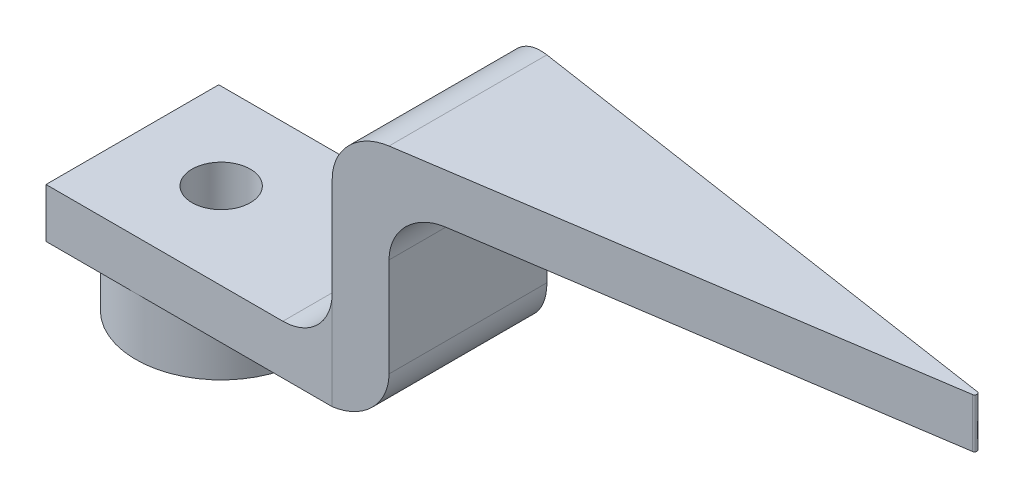
from build123d import *

# Parameters (mm, degrees)
EXTRUDE_THIN1_DEPTH = 4.445
CUT_EXTRUDE1_DEPTH  = 42.846259104
FILLET1_R           = 2.54
SKETCH3_R           = 1.5
CUT_EXTRUDE2_DEPTH  = 41.449549459
SKETCH4_R           = 4.4
BOSS_EXTRUDE1_DEPTH = 3
CUT_EXTRUDE3_DEPTH  = 3


with BuildPart() as part:
    # Sketch1 → Extrude-Thin1 (new, symmetric)
    with BuildSketch(Plane.XY):
        Polygon((39.624, 10.16), (12.7, 10.16), (12.7, 0), (0, 0), (-4.572, 0), (-4.572, 2.54), (0, 2.54), (10.16, 2.54), (10.16, 12.7), (39.624, 12.7), align=None)
    extrude(amount=EXTRUDE_THIN1_DEPTH, both=True)

    # Sketch2 → Cut-Extrude1 (cut, through all)
    with BuildSketch(Plane(origin=(0, 12.7, 0), x_dir=(1, 0, 0), z_dir=(0, 1, 0))):
        with BuildLine():
            Line((10.16, 4.445), (38.791590689, 0.125578991))
            ThreePointArc((38.791590689, 0.125578991), (38.899645583, 0), (38.791590689, -0.125578991))
            Line((38.791590689, -0.125578991), (10.16, -4.445))
            Line((10.16, -4.445), (39.624, -4.445))
            Line((39.624, -4.445), (39.624, 4.445))
            Line((39.624, 4.445), (10.16, 4.445))
        make_face()
    extrude(amount=-CUT_EXTRUDE1_DEPTH, mode=Mode.SUBTRACT)

    # Fillet1
    fillet1_edges = [part.edges().sort_by_distance(p)[0] for p in [
        (10.16, 2.54, 0),
        (12.7, 10.16, 0),
        (12.7, 0, 0),
        (10.16, 12.7, 0),
    ]]
    fillet(fillet1_edges, radius=FILLET1_R)

    # Sketch3 → Cut-Extrude2 (cut, through all)
    with BuildSketch(Plane(origin=(0, 2.54, 0), x_dir=(1, 0, 0), z_dir=(0, 1, 0))):
        with Locations(Location((0, 0, 0), (0, 0, 180))):
            Circle(SKETCH3_R)
    extrude(amount=-CUT_EXTRUDE2_DEPTH, mode=Mode.SUBTRACT)

    # Sketch4 → Boss-Extrude1 (add)
    with BuildSketch(Plane.XZ):
        Circle(SKETCH4_R)
    extrude(amount=BOSS_EXTRUDE1_DEPTH)

    # Sketch5 → Cut-Extrude3 (cut)
    with BuildSketch(Plane.XZ.offset(3)):
        with BuildLine():
            ThreePointArc((0.25256566, 2.479168093), (0.183492188, 2.485235293), (0.114276653, 2.489378375))
            Line((0.114276653, 2.489378375), (0.040605305, 2.356715865))
            Line((0.040605305, 2.356715865), (-0.040605305, 2.356715865))
            Line((-0.040605305, 2.356715865), (-0.114276653, 2.489378375))
            ThreePointArc((-0.114276653, 2.489378375), (-0.183492187, 2.485235293), (-0.252565658, 2.479168093))
            Line((-0.252565658, 2.479168093), (-0.268731935, 2.342929811))
            Line((-0.268731935, 2.342929811), (-0.349152209, 2.331627478))
            Line((-0.349152209, 2.331627478), (-0.440569645, 2.452745856))
            ThreePointArc((-0.440569645, 2.452745856), (-0.518115927, 2.437543791), (-0.595141217, 2.419890654))
            Line((-0.595141217, 2.419890654), (-0.592189461, 2.282728322))
            Line((-0.592189461, 2.282728322), (-0.67025411, 2.260343644))
            Line((-0.67025411, 2.260343644), (-0.777638298, 2.367560458))
            ThreePointArc((-0.777638298, 2.367560458), (-0.852314187, 2.341713982), (-0.92613303, 2.313512796))
            Line((-0.92613303, 2.313512796), (-0.904120693, 2.178096123))
            Line((-0.904120693, 2.178096123), (-0.978310277, 2.145064792))
            Line((-0.978310277, 2.145064792), (-1.099571107, 2.236293189))
            ThreePointArc((-1.099571107, 2.236293189), (-1.16992312, 2.200305374), (-1.239098717, 2.162105042))
            Line((-1.239098717, 2.162105042), (-1.231275144, 2.010560987))
            Line((-1.231275144, 2.010560987), (-1.267324748, 1.988034694))
            Line((-1.267324748, 1.988034694), (-1.400102014, 2.061499017))
            ThreePointArc((-1.400102014, 2.061499017), (-1.46476083, 2.016070325), (-1.527946757, 1.968614374))
            Line((-1.527946757, 1.968614374), (-1.499108466, 1.819633966))
            Line((-1.499108466, 1.819633966), (-1.531672184, 1.792309762))
            Line((-1.531672184, 1.792309762), (-1.673381528, 1.846580111))
            ThreePointArc((-1.673381528, 1.846580111), (-1.731088638, 1.79259476), (-1.787055051, 1.736806866))
            Line((-1.787055051, 1.736806866), (-1.737763347, 1.593289839))
            Line((-1.737763347, 1.593289839), (-1.766207363, 1.561699559))
            Line((-1.766207363, 1.561699559), (-1.914090574, 1.595719624))
            ThreePointArc((-1.914090574, 1.595719624), (-1.963722774, 1.534228377), (-2.011380352, 1.471194388))
            Line((-2.011380352, 1.471194388), (-1.942594641, 1.335934138))
            Line((-1.942594641, 1.335934138), (-1.966365325, 1.300692651))
            Line((-1.966365325, 1.300692651), (-2.117544025, 1.31380027))
            ThreePointArc((-2.117544025, 1.31380027), (-2.158135279, 1.245999984), (-2.196556421, 1.176946784))
            Line((-2.196556421, 1.176946784), (-2.10961554, 1.052575999))
            Line((-2.10961554, 1.052575999), (-2.128250222, 1.01436924))
            Line((-2.128250222, 1.01436924), (-2.27978189, 1.006309287))
            ThreePointArc((-2.27978189, 1.006309287), (-2.310542137, 0.933519619), (-2.338979019, 0.859791251))
            Line((-2.338979019, 0.859791251), (-2.235575173, 0.748730665))
            Line((-2.235575173, 0.748730665), (-2.24871115, 0.708302285))
            Line((-2.24871115, 0.708302285), (-2.397646393, 0.679231639))
            ThreePointArc((-2.397646393, 0.679231639), (-2.41797692, 0.602869356), (-2.43587605, 0.525900858))
            Line((-2.43587605, 0.525900858), (-2.318021877, 0.43031214))
            Line((-2.318021877, 0.43031214), (-2.325403473, 0.388449032))
            Line((-2.325403473, 0.388449032), (-2.468843437, 0.33893352))
            ThreePointArc((-2.468843437, 0.33893352), (-2.478348532, 0.260484927), (-2.485361525, 0.181774404))
            Line((-2.485361525, 0.181774404), (-2.355350923, 0.103518079))
            Line((-2.355350923, 0.103518079), (-2.356834462, 0.06103506))
            Line((-2.356834462, 0.06103506), (-2.491987251, -0.007961554))
            ThreePointArc((-2.491987251, -0.007961554), (-2.49048191, -0.086969545), (-2.486472265, -0.165890083))
            Line((-2.486472265, -0.165890083), (-2.346835742, -0.225290843))
            Line((-2.346835742, -0.225290843), (-2.338346921, -0.306056573))
            Line((-2.338346921, -0.306056573), (-2.466627368, -0.354701666))
            ThreePointArc((-2.466627368, -0.354701666), (-2.45414089, -0.432731253), (-2.439186651, -0.510325708))
            Line((-2.439186651, -0.510325708), (-2.292642072, -0.549714736))
            Line((-2.292642072, -0.549714736), (-2.272995447, -0.628513044))
            Line((-2.272995447, -0.628513044), (-2.393257389, -0.694537914))
            ThreePointArc((-2.393257389, -0.694537914), (-2.370032809, -0.77007034), (-2.344425043, -0.844828423))
            Line((-2.344425043, -0.844828423), (-2.193824733, -0.863439056))
            Line((-2.193824733, -0.863439056), (-2.163402703, -0.938736223))
            Line((-2.163402703, -0.938736223), (-2.273305378, -1.020855771))
            ThreePointArc((-2.273305378, -1.020855771), (-2.239794736, -1.092420884), (-2.204031868, -1.162887514))
            Line((-2.204031868, -1.162887514), (-2.05230709, -1.160357518))
            Line((-2.05230709, -1.160357518), (-2.011701785, -1.230687969))
            Line((-2.011701785, -1.230687969), (-2.109106063, -1.327303831))
            ThreePointArc((-2.109106063, -1.327303831), (-2.065961605, -1.393508698), (-2.02073972, -1.458312322))
            Line((-2.02073972, -1.458312322), (-1.870843625, -1.43469094))
            Line((-1.870843625, -1.43469094), (-1.820845381, -1.498685774))
            Line((-1.820845381, -1.498685774), (-1.903855398, -1.607917433))
            ThreePointArc((-1.903855398, -1.607917433), (-1.864504528, -1.653386437), (-1.824068017, -1.697892727))
            Line((-1.824068017, -1.697892727), (-1.680805986, -1.654215278))
            Line((-1.680805986, -1.654215278), (-1.622387962, -1.710628908))
            Line((-1.622387962, -1.710628908), (-1.661548352, -1.85723475))
            ThreePointArc((-1.661548352, -1.85723475), (-1.601826703, -1.908982729), (-1.540494338, -1.958811129))
            Line((-1.540494338, -1.958811129), (-1.402915898, -1.894787836))
            Line((-1.402915898, -1.894787836), (-1.337215135, -1.942522235))
            Line((-1.337215135, -1.942522235), (-1.386901159, -2.070403106))
            ThreePointArc((-1.386901159, -2.070403106), (-1.32055879, -2.113335829), (-1.252888534, -2.154143488))
            Line((-1.252888534, -2.154143488), (-1.125559319, -2.071596047))
            Line((-1.125559319, -2.071596047), (-1.053854606, -2.109722119))
            Line((-1.053854606, -2.109722119), (-1.085259511, -2.24327342))
            ThreePointArc((-1.085259511, -2.24327342), (-1.013587702, -2.276555252), (-0.94089668, -2.307547894))
            Line((-0.94089668, -2.307547894), (-0.826295007, -2.208082997))
            Line((-0.826295007, -2.208082997), (-0.749981996, -2.235858662))
            Line((-0.749981996, -2.235858662), (-0.762494522, -2.372480969))
            ThreePointArc((-0.762494522, -2.372480969), (-0.686888282, -2.395464116), (-0.610591342, -2.416038505))
            Line((-0.610591342, -2.416038505), (-0.510947803, -2.301592124))
            Line((-0.510947803, -2.301592124), (-0.431511839, -2.318476759))
            Line((-0.431511839, -2.318476759), (-0.424888445, -2.455510875))
            ThreePointArc((-0.424888445, -2.455510875), (-0.346819363, -2.467747997), (-0.268401538, -2.477503675))
            Line((-0.268401538, -2.477503675), (-0.185655581, -2.350303378))
            Line((-0.185655581, -2.350303378), (-0.104642796, -2.355968344))
            Line((-0.104642796, -2.355968344), (-0.079012397, -2.490747054))
            ThreePointArc((-0.079012397, -2.490747054), (0, -2.491999969), (0.079012397, -2.490747054))
            Line((0.079012397, -2.490747054), (0.143250216, -2.35326865))
            Line((0.143250216, -2.35326865), (0.224263001, -2.347603684))
            Line((0.224263001, -2.347603684), (0.268401538, -2.477503675))
            ThreePointArc((0.268401538, -2.477503675), (0.346819363, -2.467747997), (0.424888445, -2.455510875))
            Line((0.424888445, -2.455510875), (0.46936781, -2.310430224))
            Line((0.46936781, -2.310430224), (0.548803773, -2.293545589))
            Line((0.548803773, -2.293545589), (0.610591342, -2.416038505))
            ThreePointArc((0.610591342, -2.416038505), (0.686888282, -2.395464116), (0.762494522, -2.372480969))
            Line((0.762494522, -2.372480969), (0.786349694, -2.222621902))
            Line((0.786349694, -2.222621902), (0.862662704, -2.194846238))
            Line((0.862662704, -2.194846238), (0.94089668, -2.307547894))
            ThreePointArc((0.94089668, -2.307547894), (1.013587702, -2.276555252), (1.085259511, -2.24327342))
            Line((1.085259511, -2.24327342), (1.088026175, -2.091552774))
            Line((1.088026175, -2.091552774), (1.159730887, -2.053426702))
            Line((1.159730887, -2.053426702), (1.252888534, -2.154143488))
            ThreePointArc((1.252888534, -2.154143488), (1.32055879, -2.113335829), (1.386901159, -2.070403106))
            Line((1.386901159, -2.070403106), (1.368525464, -1.919773949))
            Line((1.368525464, -1.919773949), (1.434226228, -1.87203955))
            Line((1.434226228, -1.87203955), (1.540494338, -1.958811129))
            ThreePointArc((1.540494338, -1.958811129), (1.601826703, -1.908982729), (1.661548352, -1.85723475))
            Line((1.661548352, -1.85723475), (1.622387962, -1.710628908))
            Line((1.622387962, -1.710628908), (1.680805986, -1.654215278))
            Line((1.680805986, -1.654215278), (1.798116172, -1.72535274))
            ThreePointArc((1.798116172, -1.72535274), (1.851916882, -1.66747345), (1.903855398, -1.607917433))
            Line((1.903855398, -1.607917433), (1.820845381, -1.498685774))
            Line((1.820845381, -1.498685774), (1.870843625, -1.43469094))
            Line((1.870843625, -1.43469094), (2.02073972, -1.458312322))
            ThreePointArc((2.02073972, -1.458312322), (2.065961605, -1.393508698), (2.109106063, -1.327303831))
            Line((2.109106063, -1.327303831), (2.011701785, -1.230687969))
            Line((2.011701785, -1.230687969), (2.05230709, -1.160357518))
            Line((2.05230709, -1.160357518), (2.204031868, -1.162887514))
            ThreePointArc((2.204031868, -1.162887514), (2.239794736, -1.092420884), (2.273305378, -1.020855771))
            Line((2.273305378, -1.020855771), (2.163402703, -0.938736223))
            Line((2.163402703, -0.938736223), (2.193824733, -0.863439056))
            Line((2.193824733, -0.863439056), (2.344425043, -0.844828423))
            ThreePointArc((2.344425043, -0.844828423), (2.370032809, -0.77007034), (2.393257389, -0.694537914))
            Line((2.393257389, -0.694537914), (2.272995447, -0.628513044))
            Line((2.272995447, -0.628513044), (2.292642072, -0.549714736))
            Line((2.292642072, -0.549714736), (2.439186651, -0.510325708))
            ThreePointArc((2.439186651, -0.510325708), (2.45414089, -0.432731253), (2.466627368, -0.354701666))
            Line((2.466627368, -0.354701666), (2.338346921, -0.306056573))
            Line((2.338346921, -0.306056573), (2.346835742, -0.225290843))
            Line((2.346835742, -0.225290843), (2.486472265, -0.165890083))
            ThreePointArc((2.486472265, -0.165890083), (2.49048191, -0.086969545), (2.491987251, -0.007961554))
            Line((2.491987251, -0.007961554), (2.358185194, 0.022356941))
            Line((2.358185194, 0.022356941), (2.355350985, 0.103518079))
            Line((2.355350985, 0.103518079), (2.485361525, 0.181774404))
            ThreePointArc((2.485361525, 0.181774404), (2.478348532, 0.260484927), (2.468843437, 0.33893352))
            Line((2.468843437, 0.33893352), (2.332123952, 0.350335302))
            Line((2.332123952, 0.350335302), (2.318021877, 0.43031214))
            Line((2.318021877, 0.43031214), (2.43587605, 0.525900858))
            ThreePointArc((2.43587605, 0.525900858), (2.41797692, 0.602869356), (2.397646393, 0.679231639))
            Line((2.397646393, 0.679231639), (2.260670631, 0.671494785))
            Line((2.260670631, 0.671494785), (2.235575173, 0.748730665))
            Line((2.235575173, 0.748730665), (2.338979019, 0.859791251))
            ThreePointArc((2.338979019, 0.859791251), (2.310542137, 0.933519619), (2.27978189, 1.006309287))
            Line((2.27978189, 1.006309287), (2.145215929, 0.979584386))
            Line((2.145215929, 0.979584386), (2.10961554, 1.052575999))
            Line((2.10961554, 1.052575999), (2.196556421, 1.176946784))
            ThreePointArc((2.196556421, 1.176946784), (2.158135279, 1.245999984), (2.117544025, 1.31380027))
            Line((2.117544025, 1.31380027), (1.988007038, 1.268607491))
            Line((1.988007038, 1.268607491), (1.942594641, 1.335934138))
            Line((1.942594641, 1.335934138), (2.011380352, 1.471194388))
            ThreePointArc((2.011380352, 1.471194388), (1.963722774, 1.534228377), (1.914090574, 1.595719624))
            Line((1.914090574, 1.595719624), (1.792103852, 1.532938595))
            Line((1.792103852, 1.532938595), (1.737763347, 1.593289839))
            Line((1.737763347, 1.593289839), (1.787055051, 1.736806866))
            ThreePointArc((1.787055051, 1.736806866), (1.731088638, 1.79259476), (1.673381528, 1.846580111))
            Line((1.673381528, 1.846580111), (1.561319403, 1.767432792))
            Line((1.561319403, 1.767432792), (1.499108466, 1.819633966))
            Line((1.499108466, 1.819633966), (1.527946757, 1.968614374))
            ThreePointArc((1.527946757, 1.968614374), (1.46476083, 2.016070325), (1.400102014, 2.061499017))
            Line((1.400102014, 2.061499017), (1.300145647, 1.96752592))
            Line((1.300145647, 1.96752592), (1.231275144, 2.010560987))
            Line((1.231275144, 2.010560987), (1.239098717, 2.162105042))
            ThreePointArc((1.239098717, 2.162105042), (1.16992312, 2.200305374), (1.099571107, 2.236293189))
            Line((1.099571107, 2.236293189), (1.013666035, 2.129323395))
            Line((1.013666035, 2.129323395), (0.939476452, 2.162354725))
            Line((0.939476452, 2.162354725), (0.92613303, 2.313512796))
            ThreePointArc((0.92613303, 2.313512796), (0.852314187, 2.341713982), (0.777638298, 2.367560458))
            Line((0.777638298, 2.367560458), (0.707456568, 2.249676011))
            Line((0.707456568, 2.249676011), (0.629391919, 2.272060689))
            Line((0.629391919, 2.272060689), (0.595141217, 2.419890654))
            ThreePointArc((0.595141217, 2.419890654), (0.518115927, 2.437543791), (0.440569645, 2.452745856))
            Line((0.440569645, 2.452745856), (0.387477265, 2.326241243))
            Line((0.387477265, 2.326241243), (0.307056991, 2.337543575))
            Line((0.307056991, 2.337543575), (0.25256566, 2.479168093))
        make_face()
    extrude(amount=-CUT_EXTRUDE3_DEPTH, mode=Mode.SUBTRACT)


solid = part.part
